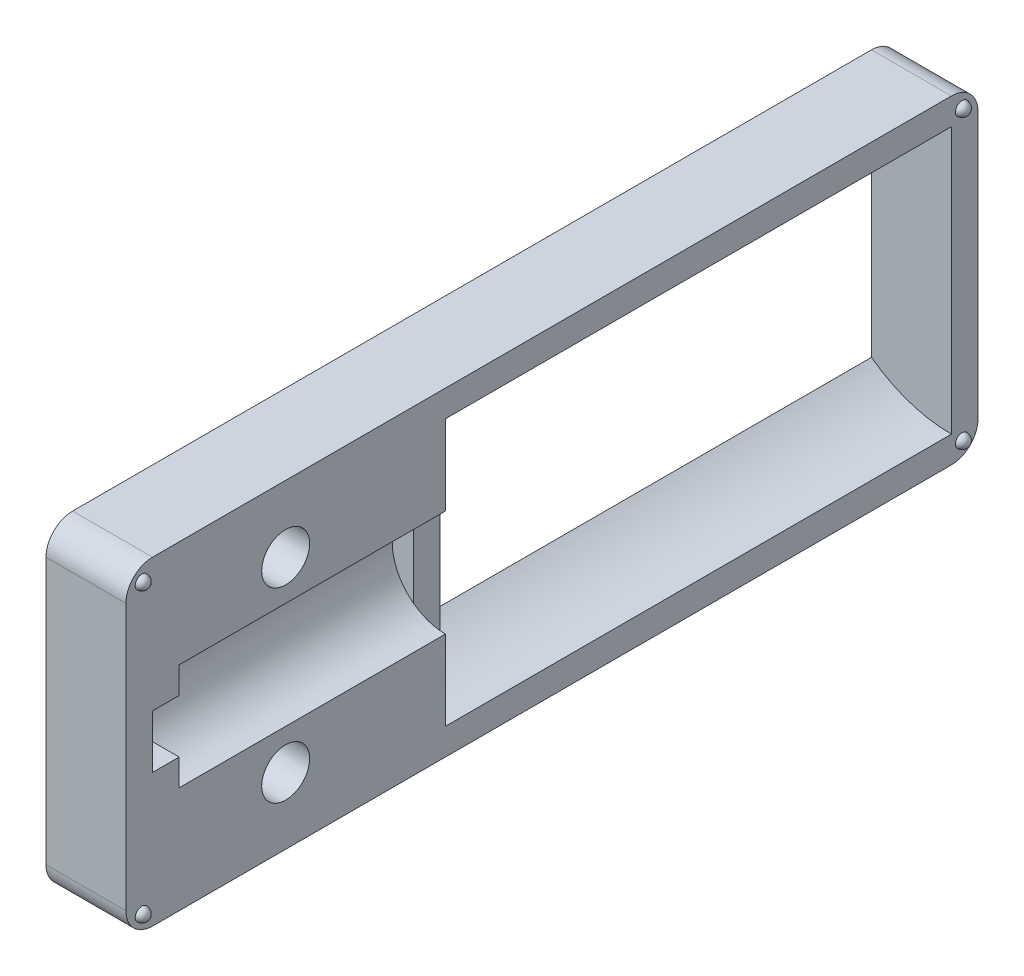
from build123d import *

# Parameters (mm, degrees)
SKETCH1_W           = 3
SKETCH1_H           = 12
BOSS_EXTRUDE1_DEPTH = 20
SKETCH2_R           = 5
CUT_EXTRUDE1_DEPTH  = 19
SKETCH6_W           = 3
SKETCH6_H           = 12
BOSS_EXTRUDE3_DEPTH = 12
SKETCH13_W          = 1.8
SKETCH13_H          = 12
BOSS_EXTRUDE4_DEPTH = 1
SKETCH7_R           = 2
CUT_EXTRUDE2_DEPTH  = 10
CUT_EXTRUDE3_DEPTH  = 1
SKETCH11_R          = 1.6
CUT_EXTRUDE4_DEPTH  = 0.6
SKETCH12_R          = 0.9
CUT_EXTRUDE5_DEPTH  = 24.446961424
FILLET2_R           = 1


with BuildPart() as part:
    # Sketch1 → Boss-Extrude1 (new body)
    with BuildSketch(Plane.XY):
        with Locations((1.5, 6)):
            Rectangle(SKETCH1_W, SKETCH1_H)
    extrude(amount=-BOSS_EXTRUDE1_DEPTH)

    # Sketch2 → Cut-Extrude1 (cut)
    with BuildSketch(Plane.XY):
        with Locations((3, 6)):
            Circle(SKETCH2_R)
    extrude(amount=-CUT_EXTRUDE1_DEPTH, mode=Mode.SUBTRACT)

    # Sketch6 → Boss-Extrude3 (add)
    with BuildSketch(Plane.XY):
        with Locations((1.5, 6)):
            Rectangle(SKETCH6_W, SKETCH6_H)
    extrude(amount=BOSS_EXTRUDE3_DEPTH)

    # Sketch13 → Boss-Extrude4 (add)
    with BuildSketch(Plane.XY):
        with Locations((0.9, 6)):
            Rectangle(SKETCH13_W, SKETCH13_H)
    extrude(amount=-BOSS_EXTRUDE4_DEPTH)

    # Sketch7 → Cut-Extrude2 (cut)
    with BuildSketch(Plane(origin=(0, 0, 0), x_dir=(-1, 0, 0), z_dir=(0, 0, -1))):
        with Locations((-3, 6)):
            Circle(SKETCH7_R)
    extrude(amount=-CUT_EXTRUDE2_DEPTH, mode=Mode.SUBTRACT)

    # Sketch10 → Cut-Extrude3 (cut)
    with BuildSketch(Plane(origin=(0, 0, 10), x_dir=(-1, 0, 0), z_dir=(0, 0, -1))):
        with BuildLine():
            Line((-3, 7), (-1.267949192, 7))
            ThreePointArc((-1.267949192, 7), (-1, 6), (-1.267949192, 5))
            Line((-1.267949192, 5), (-3, 5))
            Line((-3, 5), (-3, 7))
        make_face()
    extrude(amount=-CUT_EXTRUDE3_DEPTH, mode=Mode.SUBTRACT)

    # Sketch11 → Cut-Extrude4 (cut)
    with BuildSketch(Plane.ZY):
        with Locations((6, 9.5)):
            Circle(SKETCH11_R)
    cut_extrude4 = extrude(amount=-CUT_EXTRUDE4_DEPTH, mode=Mode.SUBTRACT)

    # Sketch12 → Cut-Extrude5 (cut, through all)
    with BuildSketch(Plane.ZY.offset(-0.6)):
        with Locations((6, 9.5)):
            Circle(SKETCH12_R)
    cut_extrude5 = extrude(amount=-CUT_EXTRUDE5_DEPTH, mode=Mode.SUBTRACT)

    # Mirror1: Cut-Extrude4, Cut-Extrude5 across plane
    add(cut_extrude4.mirror(Plane(origin=(0, 6, 0), x_dir=(0, 0, 1), z_dir=(0, -1, 0))), mode=Mode.SUBTRACT)
    add(cut_extrude5.mirror(Plane(origin=(0, 6, 0), x_dir=(0, 0, 1), z_dir=(0, -1, 0))), mode=Mode.SUBTRACT)

    # Fillet2
    fillet2_edges = [part.edges().sort_by_distance(p)[0] for p in [
        (1.5, 0, 12),
        (1.5, 12, 12),
        (1.5, 0, -20),
        (1.5, 12, -20),
    ]]
    fillet(fillet2_edges, radius=FILLET2_R)

    # Sketch16 → Revolve3 (revolve)
    with BuildSketch(Plane(origin=(0, 0, -19.4), x_dir=(-1, 0, 0), z_dir=(0, 0, -1))):
        with BuildLine():
            Line((-3.25, 11.4), (-3, 11.4))
            Line((-3, 11.4), (-3, 11.15))
            ThreePointArc((-3, 11.15), (-3.176776695, 11.223223305), (-3.25, 11.4))
        make_face()
    revolve3 = revolve(axis=Axis((3.25, 11.4, -19.4), (-1, 0, 0)))

    # Mirror2: Revolve3 across plane
    add(revolve3.mirror(Plane(origin=(0, 6, 0), x_dir=(0, 0, 1), z_dir=(0, -1, 0))))

    # Mirror2 at the second plane: Revolve3 across plane
    add(revolve3.mirror(Plane.XY.offset(-4)))

    # Mirror2 at the second plane copy 1 sketc → Mirror2 at the second plane copy 1 (revolve)
    with BuildSketch(Plane(origin=(0, 12, 11.4), x_dir=(-1, 0, 0), z_dir=(0, 0, 1))):
        with BuildLine():
            Line((-3.25, 11.4), (-3, 11.4))
            Line((-3, 11.4), (-3, 11.15))
            ThreePointArc((-3, 11.15), (-3.176776695, 11.223223305), (-3.25, 11.4))
        make_face()
    revolve(axis=Axis((3.25, 0.6, 11.4), (-1, 0, 0)))


solid = part.part
